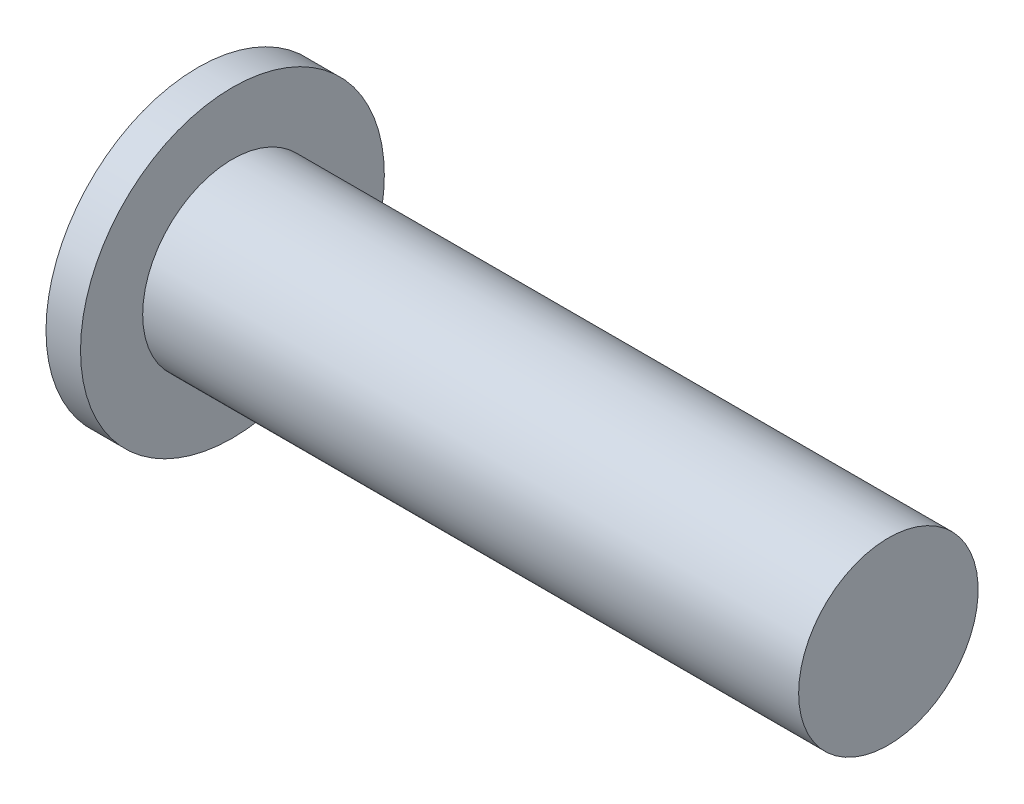
from build123d import *

# Parameters (mm, degrees)
SKETCH1_R           = 13
SKETCH1_R_2         = 11
BOSS_EXTRUDE1_DEPTH = 90
SKETCH2_R           = 13
BOSS_EXTRUDE2_DEPTH = 5
BOSS_EXTRUDE4_START = 5
SKETCH3_R           = 22
SKETCH3_R_2         = 11
BOSS_EXTRUDE4_DEPTH = 5


with BuildPart() as part:
    # Sketch1 → Boss-Extrude1 (new body)
    with BuildSketch(Plane(origin=(0, 0, 0), x_dir=(0, 0, -1), z_dir=(1, 0, 0))):
        with Locations(Location((0, 0, 0), (0, 0, 180))):
            Circle(SKETCH1_R)
        with Locations(Location((0, 0, 0), (0, 0, 180))):
            Circle(SKETCH1_R_2, mode=Mode.SUBTRACT)
    extrude(amount=BOSS_EXTRUDE1_DEPTH)

    # Sketch2 → Boss-Extrude2 (add)
    with BuildSketch(Plane(origin=(90, 0, 0), x_dir=(0, 0, -1), z_dir=(1, 0, 0))):
        with Locations(Location((0, 0, 0), (0, 0, 180))):
            Circle(SKETCH2_R)
    extrude(amount=BOSS_EXTRUDE2_DEPTH)

    # Sketch3 → Boss-Extrude4 (add)
    with BuildSketch(Plane.ZY.offset(BOSS_EXTRUDE4_START)):
        Circle(SKETCH3_R)
        Circle(SKETCH3_R_2, mode=Mode.SUBTRACT)
    extrude(amount=-BOSS_EXTRUDE4_DEPTH)


solid = part.part
